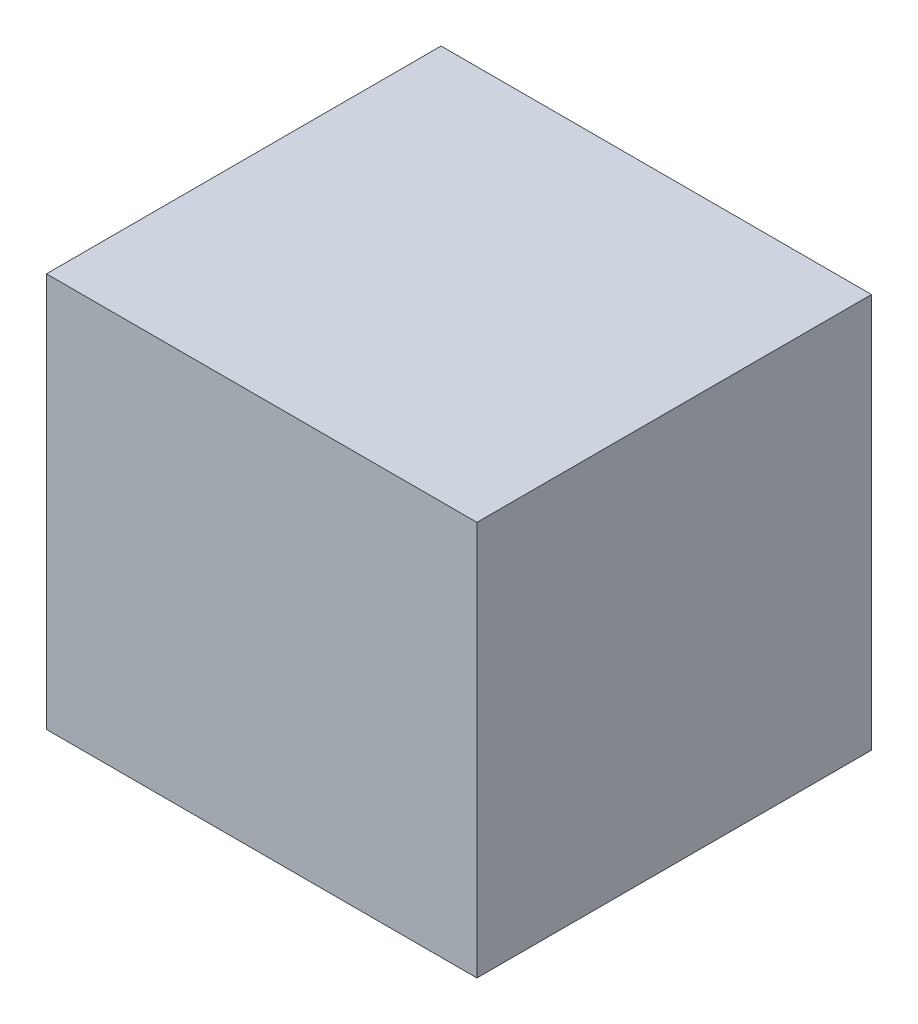
from build123d import *

# Parameters (mm, degrees)
SKETCH1_W           = 2400
SKETCH1_H           = 2200
BOSS_EXTRUDE1_DEPTH = 2200
SKETCH2_R           = 320
BOSS_EXTRUDE2_DEPTH = 430


with BuildPart() as part:
    # Sketch1 → Boss-Extrude1 (new body)
    with BuildSketch(Plane(origin=(0, 0, 0), x_dir=(-1, 0, 0), z_dir=(0, 1, 0))):
        Rectangle(SKETCH1_W, SKETCH1_H)
    extrude(amount=BOSS_EXTRUDE1_DEPTH)

    # Sketch2 → Boss-Extrude2 (add)
    with BuildSketch(Plane(origin=(0, 0, 0), x_dir=(-1, 0, 0), z_dir=(0, -1, 0))):
        with Locations(Location((0, 0, 0), (0, 0, 90))):
            Circle(SKETCH2_R)
    extrude(amount=BOSS_EXTRUDE2_DEPTH)


solid = part.part
